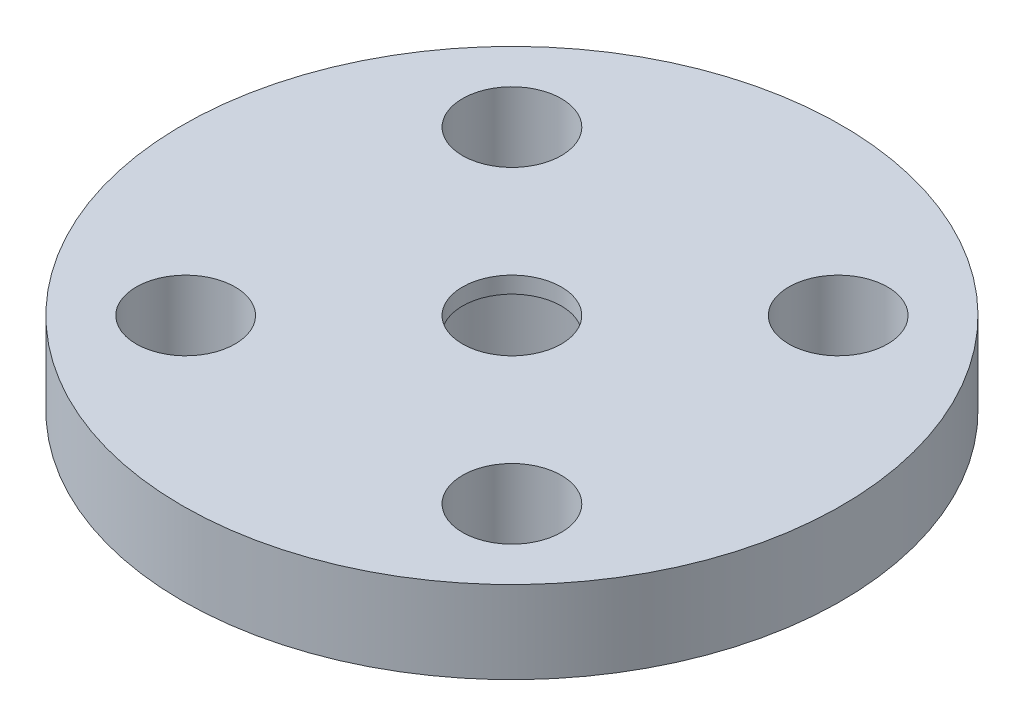
from build123d import *

# Parameters (mm, degrees)
SKETCH_1_R          = 10
SKETCH_1_R_2        = 1.5
EXTRUDE_1_DEPTH     = 2.5
SKETCH_2_R          = 4.5
EXTRUDE_2_DEPTH     = 2
SKETCH_3_R          = 2.75
CUT_EXTRUDE_1_DEPTH = 4


with BuildPart() as part:
    # 草图1 → 凸台-拉伸1 (new body)
    with BuildSketch(Plane(origin=(0, 0, 0), x_dir=(1, 0, 0), z_dir=(0, 1, 0))):
        with Locations(Location((0, 0, 0), (0, 0, 270))):
            Circle(SKETCH_1_R)
        with Locations(Location((0, 0, 0), (0, 0, 270))):
            Circle(SKETCH_1_R_2, mode=Mode.SUBTRACT)
        with Locations(Location((-4.949747468, 4.949747468, 0), (0, 0, 270))):
            Circle(SKETCH_1_R_2, mode=Mode.SUBTRACT)
        with Locations(Location((4.949747468, 4.949747468, 0), (0, 0, 270))):
            Circle(SKETCH_1_R_2, mode=Mode.SUBTRACT)
        with Locations(Location((4.949747468, -4.949747468, 0), (0, 0, 270))):
            Circle(SKETCH_1_R_2, mode=Mode.SUBTRACT)
        with Locations(Location((-4.949747468, -4.949747468, 0), (0, 0, 270))):
            Circle(SKETCH_1_R_2, mode=Mode.SUBTRACT)
    extrude(amount=EXTRUDE_1_DEPTH)

    # 草图2 → 凸台-拉伸2 (add)
    with BuildSketch(Plane.XZ):
        with Locations(Location((0, 0, 0), (0, 0, 90))):
            Circle(SKETCH_2_R)
    extrude(amount=EXTRUDE_2_DEPTH)

    # 草图3 → 切除-拉伸1 (cut)
    with BuildSketch(Plane.XZ.offset(2)):
        with Locations(Location((0, 0, 0), (0, 0, 270))):
            Circle(SKETCH_3_R)
    extrude(amount=-CUT_EXTRUDE_1_DEPTH, mode=Mode.SUBTRACT)


solid = part.part
